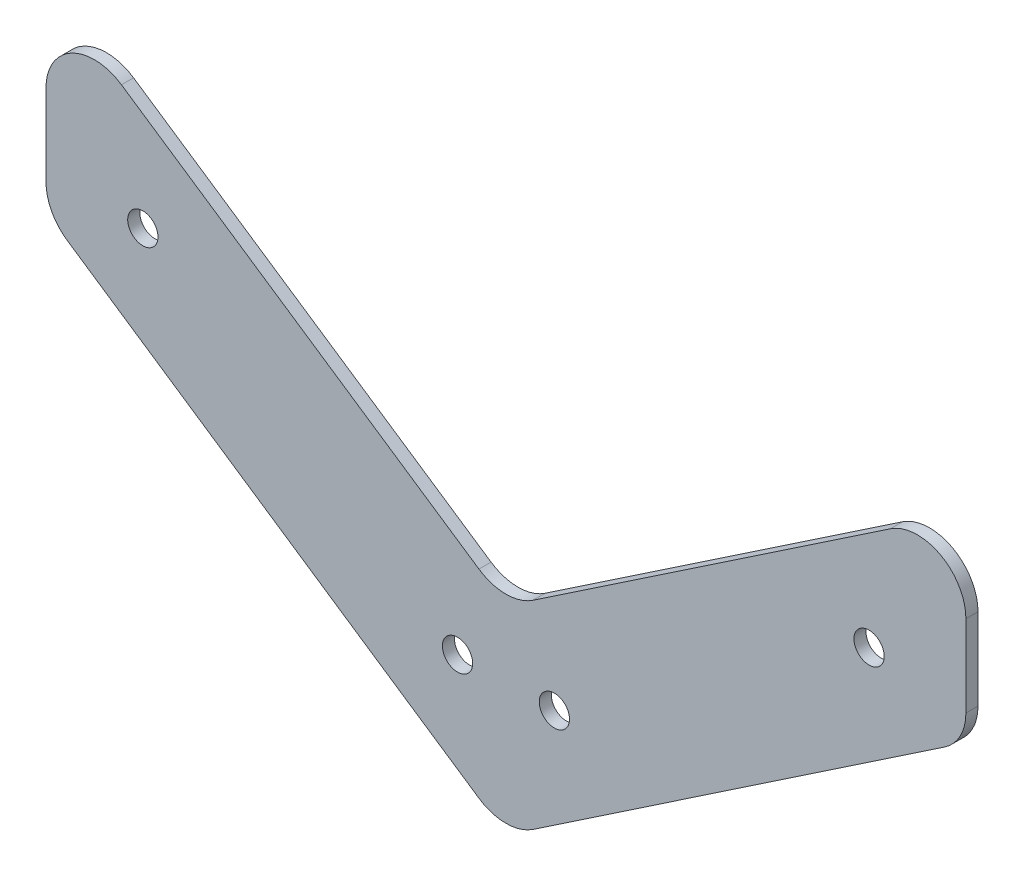
from build123d import *

# Parameters (mm, degrees)
SKETCH1_R           = 3.96875
BOSS_EXTRUDE1_DEPTH = 3.175
FILLET1_R           = 12.7


with BuildPart() as part:
    # Sketch1 → Boss-Extrude1 (new body)
    with BuildSketch(Plane.XY):
        Polygon((0, 0), (-120.65, 81.227610635), (-120.65, 29.17348858), (0, -52.054122056), (120.65, 29.17348858), (120.65, 81.227610635), align=None)
        with Locations((-95.25, 38.1)):
            Circle(SKETCH1_R, mode=Mode.SUBTRACT)
        with Locations((95.25, 38.1)):
            Circle(SKETCH1_R, mode=Mode.SUBTRACT)
        with Locations((-12.7, -17.476786224)):
            Circle(SKETCH1_R, mode=Mode.SUBTRACT)
        with Locations((12.7, -17.476786224)):
            Circle(SKETCH1_R, mode=Mode.SUBTRACT)
    extrude(amount=BOSS_EXTRUDE1_DEPTH)

    # Fillet1
    fillet1_edges = [part.edges().sort_by_distance(p)[0] for p in [
        (120.65, 81.227610635, 1.5875),
        (120.65, 29.17348858, 1.5875),
        (0, -52.054122056, 1.5875),
        (-120.65, 29.17348858, 1.5875),
        (-120.65, 81.227610635, 1.5875),
        (0, 0, 1.5875),
    ]]
    fillet(fillet1_edges, radius=FILLET1_R)


solid = part.part
